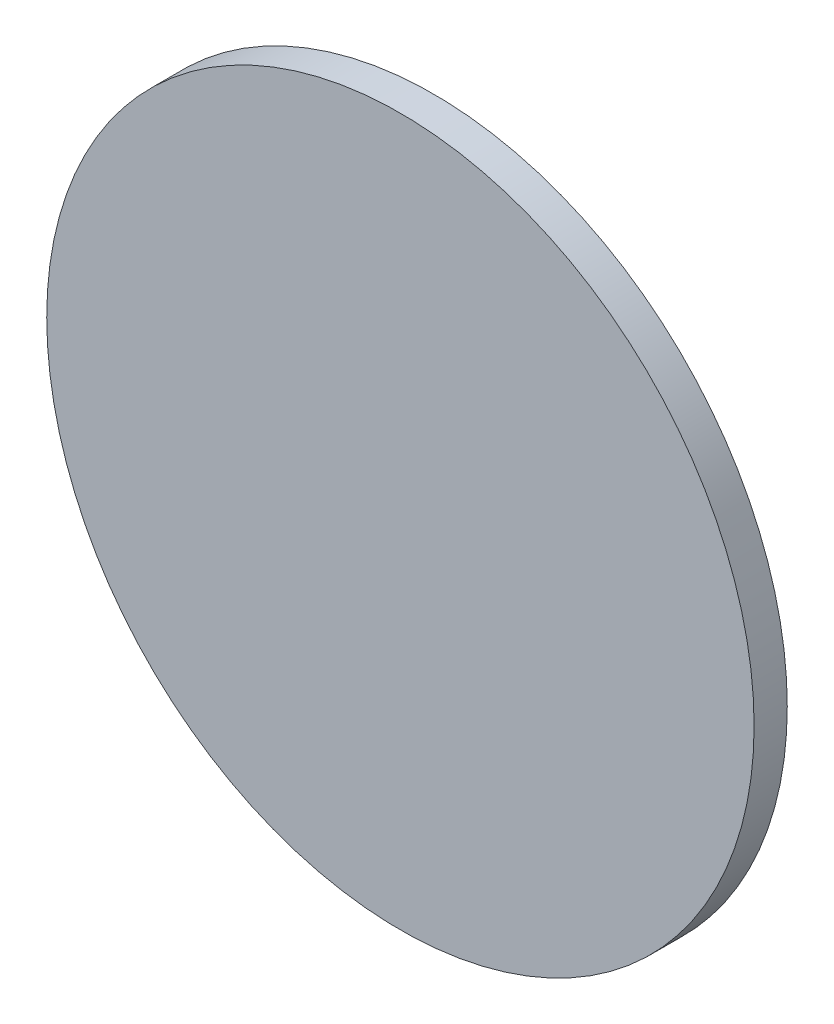
from build123d import *

# Parameters (mm, degrees)
SKETCH1_R           = 203.2
BOSS_EXTRUDE1_DEPTH = 19.05


with BuildPart() as part:
    # Sketch1 → Boss-Extrude1 (new body)
    with BuildSketch(Plane.XY):
        with Locations(Location((0, 0, 0), (0, 0, 180))):
            Circle(SKETCH1_R)
    extrude(amount=BOSS_EXTRUDE1_DEPTH)


solid = part.part
